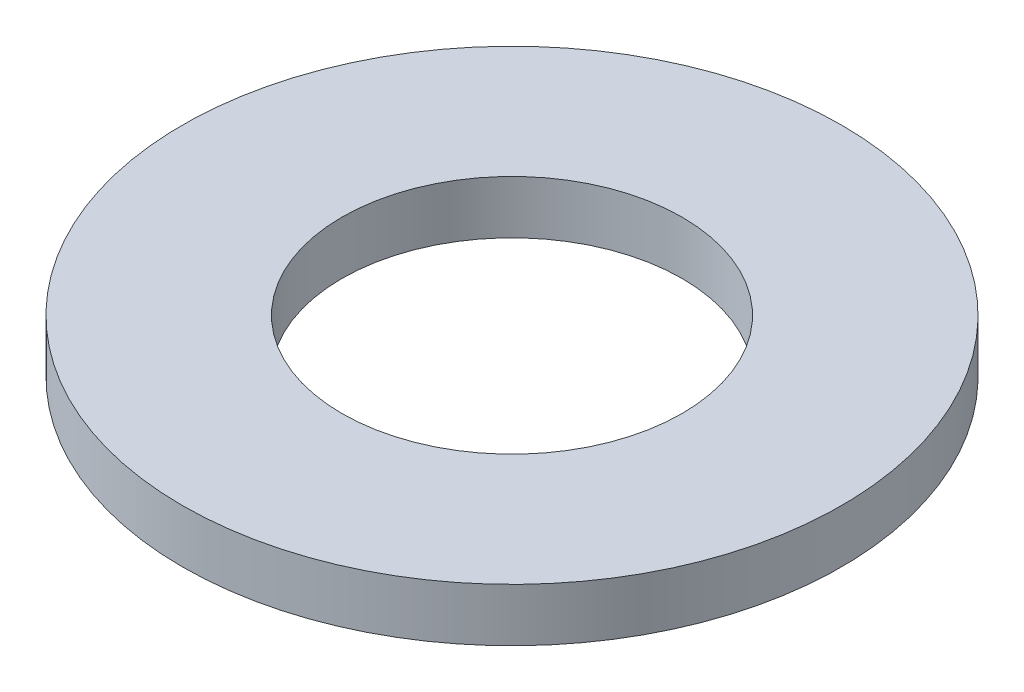
from build123d import *

# Parameters (mm, degrees)
SKETCH1_R           = 6.2
SKETCH1_R_2         = 3.2
BOSS_EXTRUDE1_DEPTH = 1


with BuildPart() as part:
    # Sketch1 → Boss-Extrude1 (new body)
    with BuildSketch(Plane(origin=(0, 0, 0), x_dir=(1, 0, 0), z_dir=(0, 1, 0))):
        with Locations(Location((0, 0, 0), (0, 0, 270))):
            Circle(SKETCH1_R)
        with Locations(Location((0, 0, 0), (0, 0, 270))):
            Circle(SKETCH1_R_2, mode=Mode.SUBTRACT)
    extrude(amount=BOSS_EXTRUDE1_DEPTH)


solid = part.part
